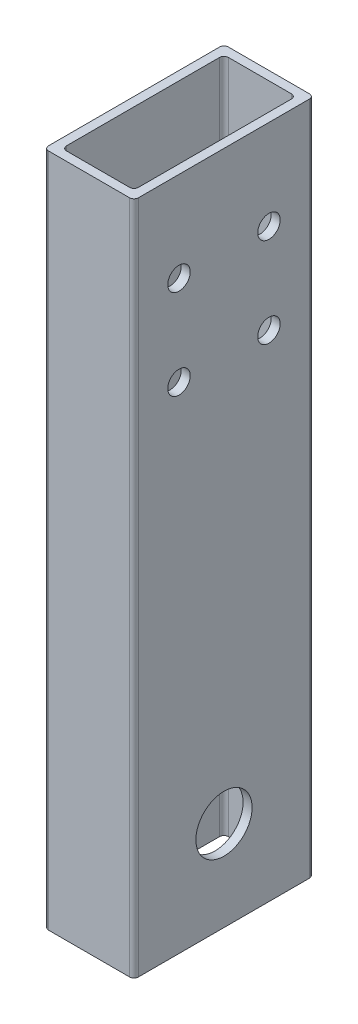
from build123d import *

# Parameters (mm, degrees)
BOSS_EXTRU_1_DEPTH      = 300
ESQUISSE3_R             = 12.5
ENL_V_MAT_EXTRU_1_DEPTH = 314.04951685
ESQUISSE4_R             = 5
ENL_V_MAT_EXTRU_2_DEPTH = 314.04951685


with BuildPart() as part:
    # Esquisse2 → Boss.-Extru.1 (new body)
    with BuildSketch(Plane(origin=(0, 0, 0), x_dir=(1, 0, 0), z_dir=(0, 1, 0))):
        with BuildLine():
            Line((2, 0), (38, 0))
            ThreePointArc((38, 0), (39.414213562, 0.585786438), (40, 2))
            Line((40, 2), (40, 78))
            ThreePointArc((40, 78), (39.414213562, 79.414213562), (38, 80))
            Line((38, 80), (2, 80))
            ThreePointArc((2, 80), (0.585786438, 79.414213562), (0, 78))
            Line((0, 78), (0, 2))
            ThreePointArc((0, 2), (0.585786438, 0.585786438), (2, 0))
        make_face()
        with BuildLine():
            Line((6, 4), (34, 4))
            ThreePointArc((34, 4), (35.414213562, 4.585786438), (36, 6))
            Line((36, 6), (36, 74))
            ThreePointArc((36, 74), (35.414213562, 75.414213562), (34, 76))
            Line((34, 76), (6, 76))
            ThreePointArc((6, 76), (4.585786438, 75.414213562), (4, 74))
            Line((4, 74), (4, 6))
            ThreePointArc((4, 6), (4.585786438, 4.585786438), (6, 4))
        make_face(mode=Mode.SUBTRACT)
    extrude(amount=BOSS_EXTRU_1_DEPTH)

    # Esquisse3 → Enlèv. mat.-Extru.1 (cut, through all)
    with BuildSketch(Plane(origin=(40, 0, 0), x_dir=(0, 0, -1), z_dir=(1, 0, 0))):
        with Locations((40, 40)):
            Circle(ESQUISSE3_R)
    extrude(amount=-ENL_V_MAT_EXTRU_1_DEPTH, mode=Mode.SUBTRACT)

    # Esquisse4 → Enlèv. mat.-Extru.2 (cut, through all)
    with BuildSketch(Plane(origin=(40, 0, 0), x_dir=(0, 0, -1), z_dir=(1, 0, 0))):
        with Locations((60, 220)):
            Circle(ESQUISSE4_R)
        with Locations((20, 220)):
            Circle(ESQUISSE4_R)
        with Locations((20, 260)):
            Circle(ESQUISSE4_R)
        with Locations((60, 260)):
            Circle(ESQUISSE4_R)
    extrude(amount=-ENL_V_MAT_EXTRU_2_DEPTH, mode=Mode.SUBTRACT)


solid = part.part
